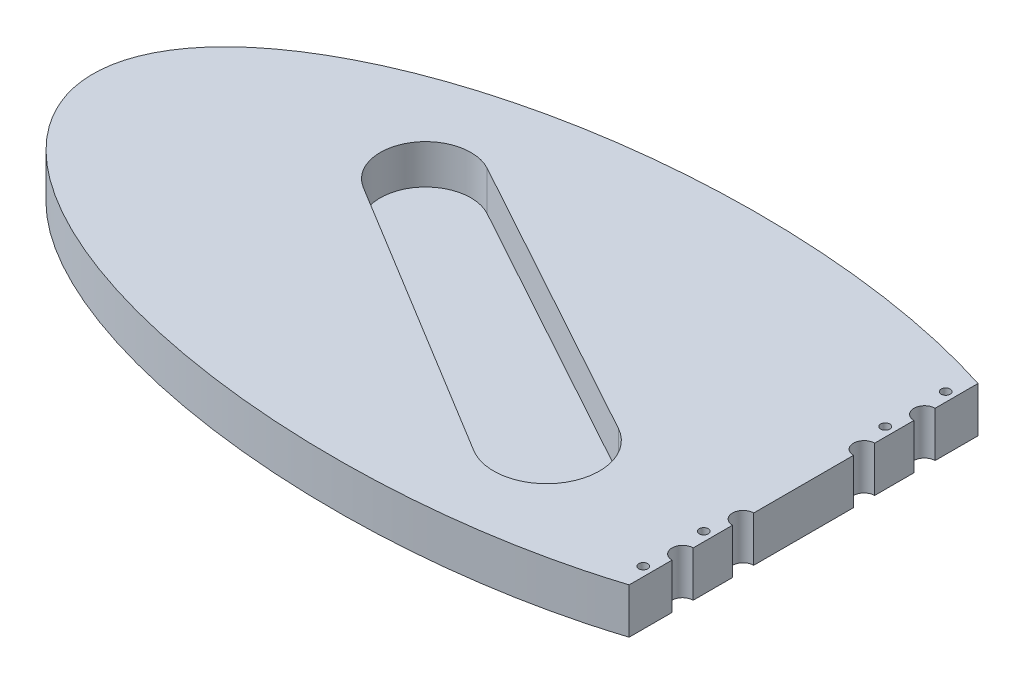
from build123d import *

# Parameters (mm, degrees)
BOSS_EXTRUDE1_DEPTH = 15
CUT_EXTRUDE1_DEPTH  = 13
SKETCH3_R           = 3.5
SKETCH3_R_2         = 1.5
CUT_EXTRUDE2_DEPTH  = 167.207701527


with BuildPart() as part:
    # Sketch1 → Boss-Extrude1 (new body)
    with BuildSketch(Plane(origin=(0, 0, 0), x_dir=(1, 0, 0), z_dir=(0, 1, 0))):
        with BuildLine():
            Line((85, 57.676299773), (85, -57.676299773))
            add(Edge.make_bspline(
                [(85, 57.676299773), (-150, 133.099153323), (-150, 0), (-150, -133.099153323), (85, -57.676299773)],
                knots=[4.109934347, 4.109934347, 4.109934347, 6.283185307, 6.283185307, 8.456436267, 8.456436267, 8.456436267], degree=2, weights=[1, 0.465474668, 1, 0.465474668, 1]))
        make_face()
    extrude(amount=BOSS_EXTRUDE1_DEPTH)

    # Sketch2 → Cut-Extrude1 (cut)
    with BuildSketch(Plane(origin=(0, 15, 0), x_dir=(1, 0, 0), z_dir=(0, 1, 0))):
        with BuildLine():
            Line((-57.7820484, 38.149189127), (38.420943533, -14.659279352))
            ThreePointArc((38.420943533, -14.659279352), (45.144959996, -38.768134734), (20.889222442, -44.941343055))
            Line((20.889222442, -44.941343055), (-72.809237907, 12.193134524))
            ThreePointArc((-72.809237907, 12.193134524), (-77.981394282, 32.515544058), (-57.7820484, 38.149189127))
        make_face()
    extrude(amount=-CUT_EXTRUDE1_DEPTH, mode=Mode.SUBTRACT)

    # Sketch3 → Cut-Extrude2 (cut, through all)
    with BuildSketch(Plane(origin=(0, 15, 0), x_dir=(1, 0, 0), z_dir=(0, 1, 0))):
        with Locations((85, 40)):
            Circle(SKETCH3_R)
        with Locations((85, 20)):
            Circle(SKETCH3_R)
        with Locations(Location((82, 30, 0), (0, 0, 270))):
            Circle(SKETCH3_R_2)
        with Locations(Location((82, 50, 0), (0, 0, 270))):
            Circle(SKETCH3_R_2)
        with Locations(Location((82, -50, 0), (0, 0, 90))):
            Circle(SKETCH3_R_2)
        with Locations((85, -40)):
            Circle(SKETCH3_R)
        with Locations(Location((82, -30, 0), (0, 0, 90))):
            Circle(SKETCH3_R_2)
        with Locations((85, -20)):
            Circle(SKETCH3_R)
    extrude(amount=-CUT_EXTRUDE2_DEPTH, mode=Mode.SUBTRACT)


solid = part.part
